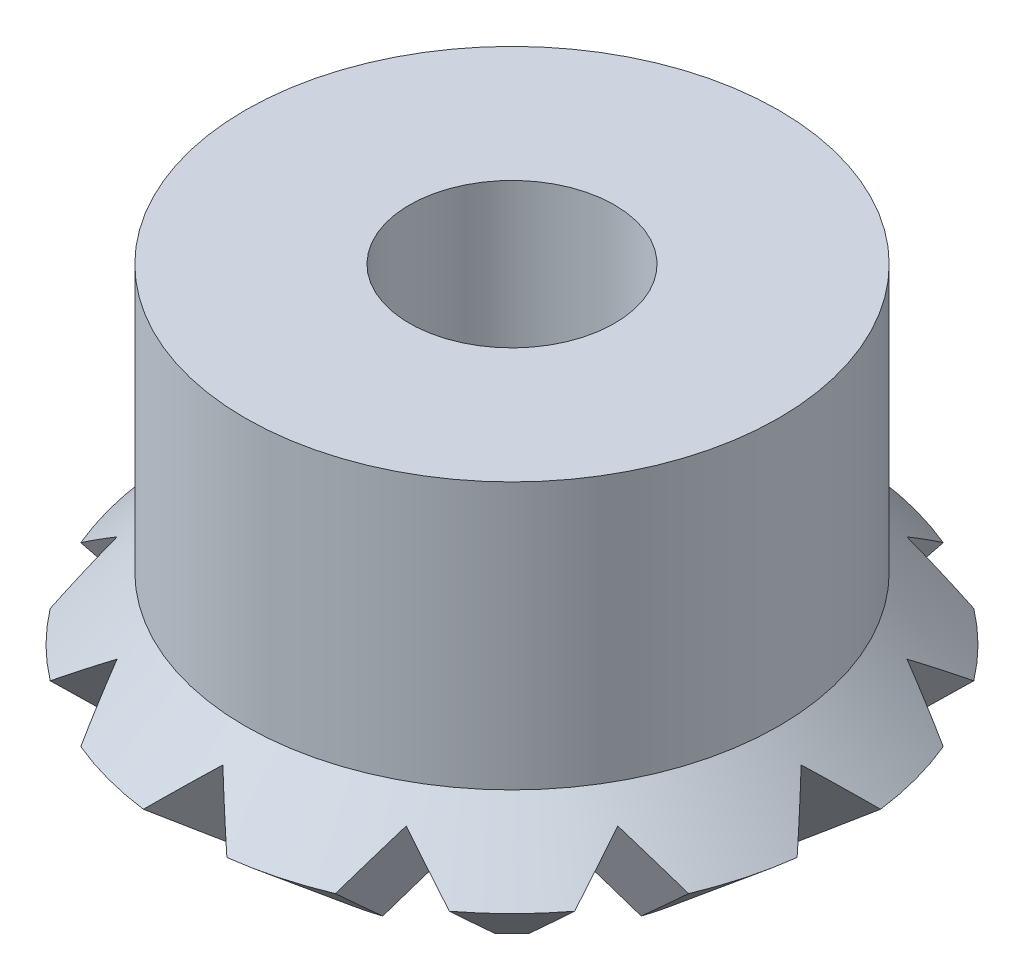
from build123d import *

# Parameters (mm, degrees)
CIRPATTERN1_COUNT = 12


with BuildPart() as part:
    # Sketch2 → Revolve1 (revolve)
    with BuildSketch(Plane.YZ, mode=Mode.PRIVATE) as revolve1_sk:
        Polygon((-11.743521681, 3.755235238), (-14.803521681, 6.815235238), (-19.967183183, 0.704867009), (-17.743521681, -1.559764762), (-17.743521681, -4.244764762), (1.256478319, -4.244764762), (1.256478319, -1.559764762), (1.256478319, 3.755235238), align=None)
    revolve(revolve1_sk.sketch.rotate(Axis((0, -25.391509901, -9.244764762), (0, 1, 0)), 180), axis=Axis((0, -25.391509901, -9.244764762), (0, 1, 0)))

    # Cut-Sweep1: sweep along a path in Sketch8
    with BuildLine(Plane.YZ) as cut_sweep1_path:
        Line((-28.743521681, -9.244764762), (-15.053364124, 6.955349006))
    # Sketch9 → Cut-Sweep1 (sweep, cut)
    with BuildSketch(Plane.XY.offset(-9.244764762)):
        Polygon((3.464101615, -30.743521681), (0, -24.743521681), (-3.464101615, -30.743521681), align=None)
    cut_sweep1 = sweep(path=cut_sweep1_path.line, mode=Mode.SUBTRACT)

    # CirPattern1: Cut-Sweep1 ×12 about axis
    cirpattern1_axis = Axis((0, 0, -9.244764762), (0, 1, 0))
    for i in range(1, CIRPATTERN1_COUNT):
        add(cut_sweep1.rotate(cirpattern1_axis, i * 360 / CIRPATTERN1_COUNT), mode=Mode.SUBTRACT)


solid = part.part
